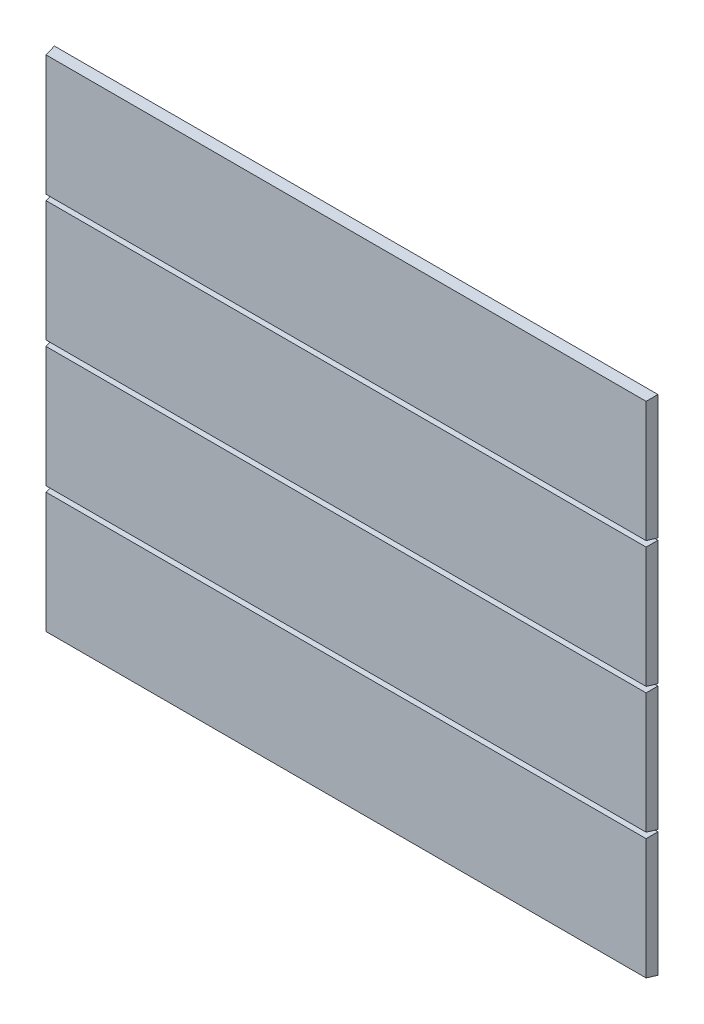
from build123d import *

# Parameters (mm, degrees)
SKETCH_1_W                = 3000
SKETCH_1_H                = 617.5
EXTRUDE_1_DEPTH           = 50
EXTRUDE_1_DRAFT           = 10
EXTRUDE_1_PROFILE_2_DEPTH = 50
EXTRUDE_1_PROFILE_2_DRAFT = 10
EXTRUDE_1_PROFILE_3_DEPTH = 50
EXTRUDE_1_PROFILE_3_DRAFT = 10
EXTRUDE_1_PROFILE_4_DEPTH = 50
EXTRUDE_1_PROFILE_4_DRAFT = 10


with BuildPart() as part:
    # Эскиз1 → Бобышка-Вытянуть1 (with draft: the straight prism first)
    with BuildSketch(Plane.XY):
        with Locations((0, -432.20542544)):
            Rectangle(SKETCH_1_W, SKETCH_1_H)
    extrude(amount=EXTRUDE_1_DEPTH)
    # Бобышка-Вытянуть1: the draft: its side faces are tilted about the plane it starts from
    extrude_1_sides = [part.faces().sort_by_distance(p)[0] for p in [
        (-1500, -432.20542544, 25),
        (0, -740.95542544, 25),
        (1500, -432.20542544, 25),
        (0, -123.45542544, 25),
    ]]
    draft(extrude_1_sides, Plane.XY, EXTRUDE_1_DRAFT)


with BuildPart() as body_2:
    # Эскиз1 → Бобышка-Вытянуть1 profile 2 (with draft: the straight prism first)
    with BuildSketch(Plane.XY):
        with Locations((0, -1059.70542544)):
            Rectangle(SKETCH_1_W, SKETCH_1_H)
    extrude(amount=EXTRUDE_1_PROFILE_2_DEPTH)
    # Бобышка-Вытянуть1 profile 2: the draft: its side faces are tilted about the plane it starts from
    extrude_1_profile_2_sides = [body_2.faces().sort_by_distance(p)[0] for p in [
        (-1500, -1059.70542544, 25),
        (0, -1368.45542544, 25),
        (1500, -1059.70542544, 25),
        (0, -750.95542544, 25),
    ]]
    draft(extrude_1_profile_2_sides, Plane.XY, EXTRUDE_1_PROFILE_2_DRAFT)


with BuildPart() as body_3:
    # Эскиз1 → Бобышка-Вытянуть1 profile 3 (with draft: the straight prism first)
    with BuildSketch(Plane.XY):
        with Locations((0, -1687.20542544)):
            Rectangle(SKETCH_1_W, SKETCH_1_H)
    extrude(amount=EXTRUDE_1_PROFILE_3_DEPTH)
    # Бобышка-Вытянуть1 profile 3: the draft: its side faces are tilted about the plane it starts from
    extrude_1_profile_3_sides = [body_3.faces().sort_by_distance(p)[0] for p in [
        (-1500, -1687.20542544, 25),
        (0, -1995.95542544, 25),
        (1500, -1687.20542544, 25),
        (0, -1378.45542544, 25),
    ]]
    draft(extrude_1_profile_3_sides, Plane.XY, EXTRUDE_1_PROFILE_3_DRAFT)


with BuildPart() as body_4:
    # Эскиз1 → Бобышка-Вытянуть1 profile 4 (with draft: the straight prism first)
    with BuildSketch(Plane.XY):
        with Locations((0, -2314.70542544)):
            Rectangle(SKETCH_1_W, SKETCH_1_H)
    extrude(amount=EXTRUDE_1_PROFILE_4_DEPTH)
    # Бобышка-Вытянуть1 profile 4: the draft: its side faces are tilted about the plane it starts from
    extrude_1_profile_4_sides = [body_4.faces().sort_by_distance(p)[0] for p in [
        (-1500, -2314.70542544, 25),
        (0, -2623.45542544, 25),
        (1500, -2314.70542544, 25),
        (0, -2005.95542544, 25),
    ]]
    draft(extrude_1_profile_4_sides, Plane.XY, EXTRUDE_1_PROFILE_4_DRAFT)


solid = Compound([part.part, body_2.part, body_3.part, body_4.part])
